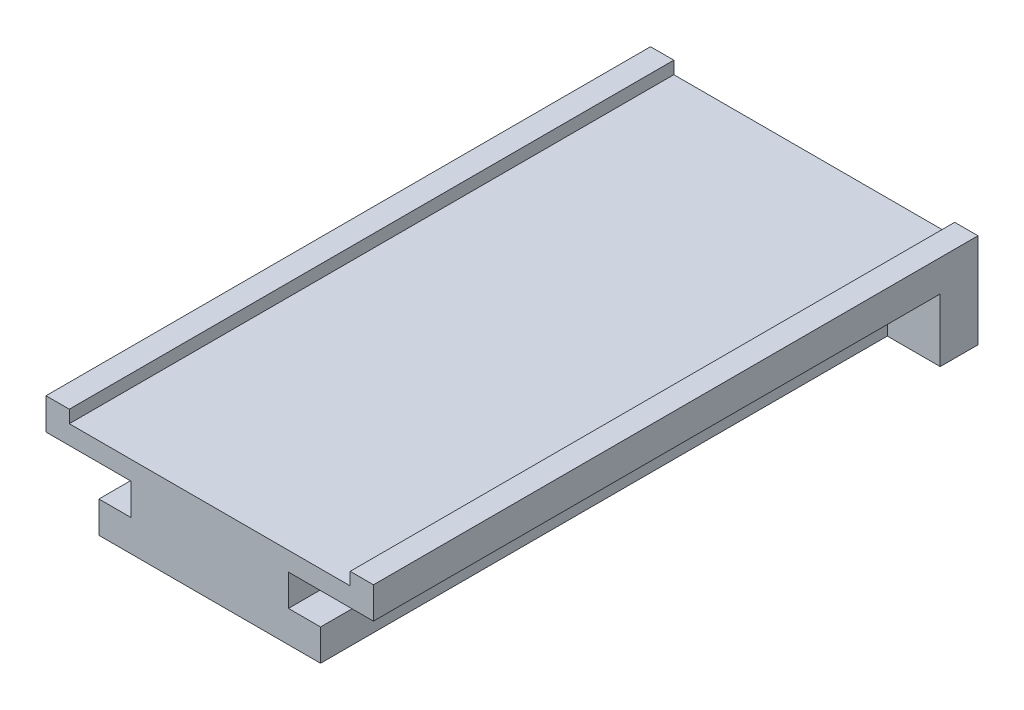
from build123d import *

# Parameters (mm, degrees)
SKETCH1_W           = 6.25
SKETCH1_H           = 2.5
SKETCH1_W_2         = 8.8
BOSS_EXTRUDE1_DEPTH = 45
SKETCH9_W           = 26
SKETCH9_H           = 7.5
BOSS_EXTRUDE3_DEPTH = 3
SKETCH10_W          = 11.15
SKETCH10_H          = 48
CUT_EXTRUDE3_DEPTH  = 1


with BuildPart() as part:
    # Sketch1 → Boss-Extrude1 (new body)
    with BuildSketch(Plane.XY):
        Polygon((-3.202898551, 2.789855072), (-3.202898551, 0.289855072), (3.047101449, 0.289855072), (9.797101449, 0.289855072), (9.797101449, 2.789855072), align=None)
        with Locations((-0.077898551, -0.960144928)):
            Rectangle(SKETCH1_W, SKETCH1_H)
        with Locations((1.197101449, -3.460144928)):
            Rectangle(SKETCH1_W_2, SKETCH1_H)
    boss_extrude1 = extrude(amount=BOSS_EXTRUDE1_DEPTH)

    # Mirror1: Boss-Extrude1 across plane
    add(boss_extrude1.mirror(Plane(origin=(-3.202898551, 0, 45), x_dir=(0, 0, 1), z_dir=(-1, 0, 0))))

    # Cut-Extrude2 cone 1 section (through the dimple's axis) → Cut-Extrude2 (revolve, cut)
    with BuildSketch(Plane(origin=(-3.202898551, -4.710144928, 32.5), x_dir=(0, 0, -1), z_dir=(1, 0, 0))):
        Polygon((0, 0), (1.5, 0), (0, 1.5), align=None)
    revolve(axis=Axis((-3.202898551, -4.710144928, 32.5), (0, 1, 0)), mode=Mode.SUBTRACT)

    # Cut-Extrude2 cone 2 section (through the dimple's axis) → Cut-Extrude2 cone 2 (revolve, cut)
    with BuildSketch(Plane(origin=(-3.202898551, -4.710144928, 12.5), x_dir=(0, 0, -1), z_dir=(1, 0, 0))):
        Polygon((0, 0), (1.5, 0), (0, 1.5), align=None)
    revolve(axis=Axis((-3.202898551, -4.710144928, 12.5), (0, 1, 0)), mode=Mode.SUBTRACT)

    # Sketch9 → Boss-Extrude3 (add)
    with BuildSketch(Plane(origin=(0, 0, 0), x_dir=(-1, 0, 0), z_dir=(0, 0, -1))):
        with Locations((3.202898551, -0.960144928)):
            Rectangle(SKETCH9_W, SKETCH9_H)
    extrude(amount=BOSS_EXTRUDE3_DEPTH)

    # Sketch10 → Cut-Extrude3 (cut)
    with BuildSketch(Plane(origin=(0, 2.789855072, 0), x_dir=(1, 0, 0), z_dir=(0, 1, 0))):
        with Locations((-8.777898551, -21)):
            Rectangle(SKETCH10_W, SKETCH10_H)
        with Locations((2.372101449, -21)):
            Rectangle(SKETCH10_W, SKETCH10_H)
    extrude(amount=-CUT_EXTRUDE3_DEPTH, mode=Mode.SUBTRACT)


solid = part.part
